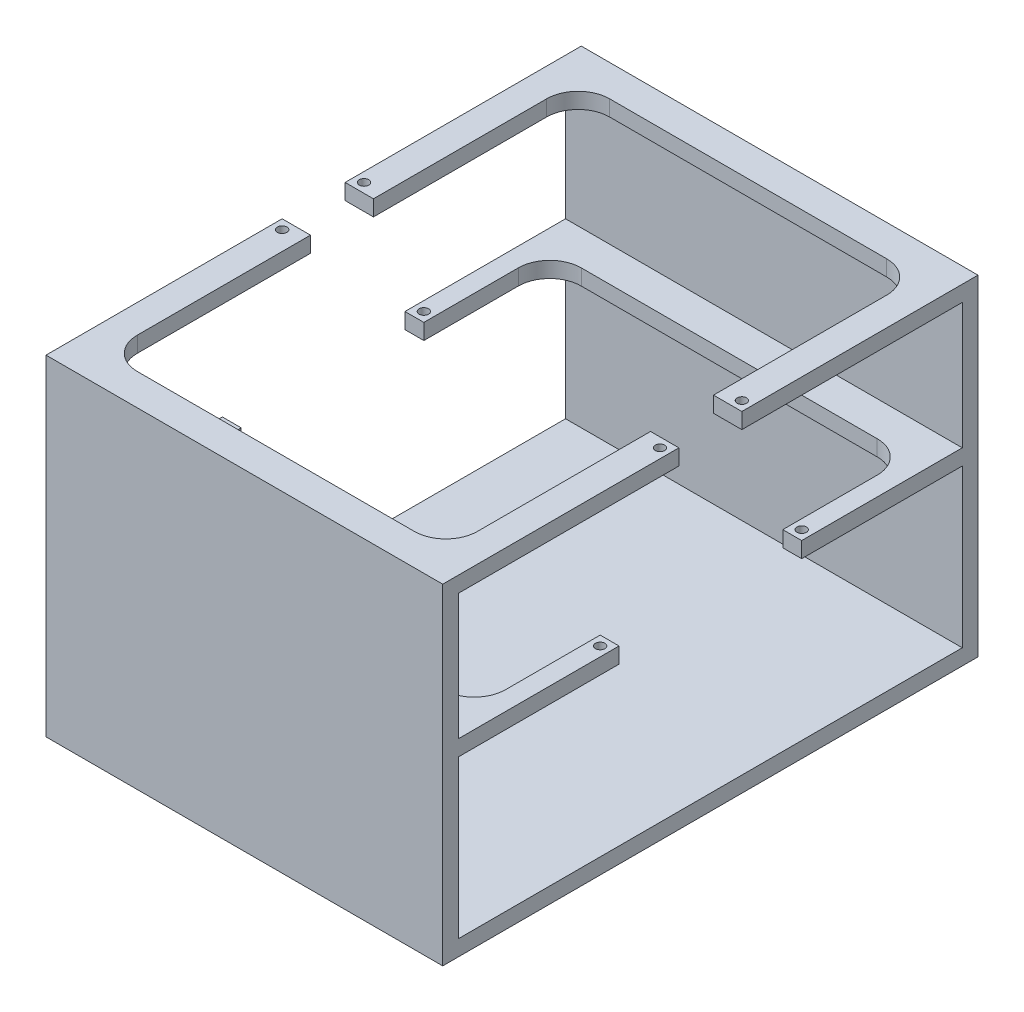
from build123d import *

# Parameters (mm, degrees)
BOSS_EXTRUDE1_DEPTH = 126
SKETCH2_R           = 1.5
CUT_EXTRUDE1_DEPTH  = 45
SKETCH3_R           = 1.5
CUT_EXTRUDE3_DEPTH  = 55
CUT_EXTRUDE6_DEPTH  = 45


with BuildPart() as part:
    # Sketch1 → Boss-Extrude1 (new body)
    with BuildSketch(Plane(origin=(0, 0, 0), x_dir=(0, 0, -1), z_dir=(1, 0, 0))):
        Polygon((-95, -3.570472346), (-95, 46.429527654), (-44, 46.429527654), (-44, 51.429527654), (-95, 51.429527654), (-95, 91.429527654), (-25, 91.429527654), (-25, 96.429527654), (-90, 96.429527654), (-100, 96.429527654), (-100, 86.429527654), (-100, -8.570472346), (-90, -8.570472346), (-15, -8.570472346), (-15, -3.570472346), align=None)
    boss_extrude1 = extrude(amount=BOSS_EXTRUDE1_DEPTH)

    # Sketch2 → Cut-Extrude1 (cut)
    with BuildSketch(Plane(origin=(0, 96.429527654, 0), x_dir=(1, 0, 0), z_dir=(0, 1, 0))):
        with Locations(Location((3, -28, 0), (0, 0, 270))):
            Circle(SKETCH2_R)
        with Locations(Location((123, -28, 0), (0, 0, 270))):
            Circle(SKETCH2_R)
    cut_extrude1 = extrude(amount=-CUT_EXTRUDE1_DEPTH, mode=Mode.SUBTRACT)

    # Sketch3 → Cut-Extrude3 (cut)
    with BuildSketch(Plane(origin=(0, 51.429527654, 0), x_dir=(1, 0, 0), z_dir=(0, 1, 0))):
        with Locations(Location((3, -47, 0), (0, 0, 270))):
            Circle(SKETCH3_R)
        with Locations(Location((123, -47, 0), (0, 0, 270))):
            Circle(SKETCH3_R)
        with BuildLine():
            Line((6, -74), (6, -44))
            Line((6, -44), (120, -44))
            Line((120, -44), (120, -74))
            ThreePointArc((120, -74), (117.071067812, -81.071067812), (110, -84))
            Line((110, -84), (16, -84))
            ThreePointArc((16, -84), (8.928932188, -81.071067812), (6, -74))
        make_face()
    cut_extrude3 = extrude(amount=-CUT_EXTRUDE3_DEPTH, mode=Mode.SUBTRACT)

    # Mirror2: Boss-Extrude1, Cut-Extrude1, Cut-Extrude3 across plane
    add(boss_extrude1.mirror(Plane(origin=(0, 0, 15), x_dir=(1, 0, 0), z_dir=(0, 0, -1))))
    add(cut_extrude1.mirror(Plane(origin=(0, 0, 15), x_dir=(1, 0, 0), z_dir=(0, 0, -1))), mode=Mode.SUBTRACT)
    add(cut_extrude3.mirror(Plane(origin=(0, 0, 15), x_dir=(1, 0, 0), z_dir=(0, 0, -1))), mode=Mode.SUBTRACT)

    # Sketch4 → Cut-Extrude6 (cut)
    with BuildSketch(Plane(origin=(0, 96.429527654, 0), x_dir=(1, 0, 0), z_dir=(0, 1, 0))):
        with BuildLine():
            Line((9, -25), (9, -80))
            ThreePointArc((9, -80), (11.928932188, -87.071067812), (19, -90))
            Line((19, -90), (107, -90))
            ThreePointArc((107, -90), (114.071067812, -87.071067812), (117, -80))
            Line((117, -80), (117, -25))
            Line((117, -25), (9, -25))
        make_face()
    cut_extrude6 = extrude(amount=-CUT_EXTRUDE6_DEPTH, mode=Mode.SUBTRACT)

    # Mirror5: Cut-Extrude6 across plane
    add(cut_extrude6.mirror(Plane(origin=(0, 0, 15), x_dir=(1, 0, 0), z_dir=(0, 0, -1))), mode=Mode.SUBTRACT)


solid = part.part
